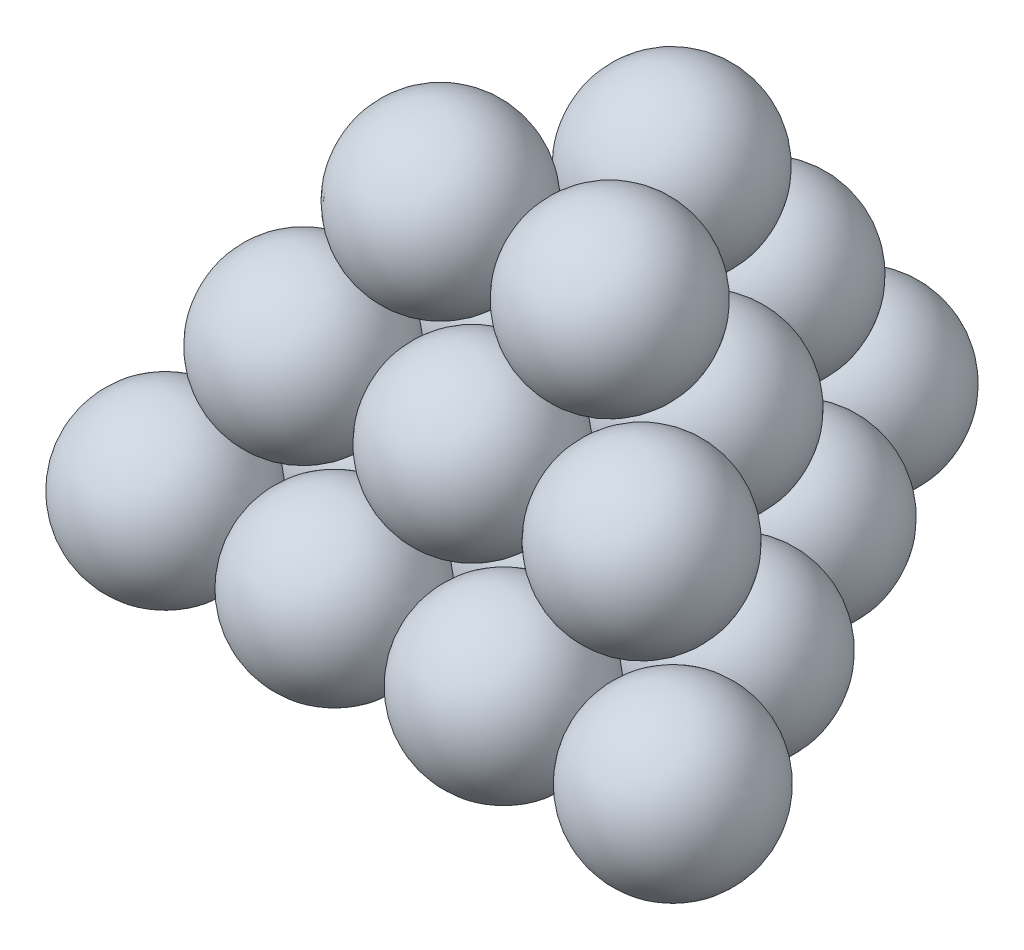
from build123d import *


with BuildPart() as part:
    # 草圖1 → 旋轉1 (revolve)
    with BuildSketch(Plane.XY):
        with BuildLine():
            ThreePointArc((0, -30), (30, 0), (0, 30))
            Line((0, 30), (0, -30))
        make_face()
    revolve(axis=Axis((0, 30, 0), (0, -1, 0)))


with BuildPart() as body_2:
    # 草圖1<8> → 旋轉2 (revolve)
    with BuildSketch(Plane.XY):
        with BuildLine():
            ThreePointArc((60, -30), (90, 0), (60, 30))
            Line((60, 30), (60, -30))
        make_face()
    revolve(axis=Axis((60, 30, 0), (0, -1, 0)))


with BuildPart() as body_3:
    # 草圖1<9> → 旋轉3 (revolve)
    with BuildSketch(Plane.XY):
        with BuildLine():
            ThreePointArc((120.355011354, -29.997899375), (149.999474839, 0.177508784), (120, 30))
            Line((120, 30), (120, -30))
            ThreePointArc((120, -30), (120.177508784, -29.999474839), (120.355011354, -29.997899375))
        make_face()
    revolve(axis=Axis((120, -30, 0), (0, -1, 0)))


with BuildPart() as body_4:
    # 草圖1<10> → 旋轉4 (revolve)
    with BuildSketch(Plane.XY):
        with BuildLine():
            Line((180, 30), (180, -30))
            ThreePointArc((180, -30), (210, 0), (180, 30))
        make_face()
    revolve(axis=Axis((180, 30, 0), (0, -1, 0)))


with BuildPart() as body_5:
    # 草圖2 → 旋轉5 (revolve)
    with BuildSketch(Plane(origin=(0, 0, 0), x_dir=(1, 0, 0), z_dir=(0, 1, 0))):
        with BuildLine():
            ThreePointArc((90, 103.923048454), (60, 133.923048454), (30, 103.923048454))
            Line((30, 103.923048454), (90, 103.923048454))
        make_face()
        with BuildLine():
            ThreePointArc((150, 103.923048454), (120, 133.923048454), (90, 103.923048454))
            Line((90, 103.923048454), (150, 103.923048454))
        make_face()
    revolve(axis=Axis((12.758715889, 0, -103.923048454), (1, 0, 0)))


with BuildPart() as body_6:
    # 草圖2<5> → 旋轉6 (revolve)
    with BuildSketch(Plane(origin=(0, 0, 0), x_dir=(1, 0, 0), z_dir=(0, 1, 0))):
        with BuildLine():
            Line((60, 51.961524227), (0, 51.961524227))
            ThreePointArc((0, 51.961524227), (30, 21.961524227), (60, 51.961524227))
        make_face()
        with BuildLine():
            Line((180, 51.961524227), (120, 51.961524227))
            ThreePointArc((120, 51.961524227), (150, 21.961524227), (180, 51.961524227))
        make_face()
    revolve(axis=Axis((-15.55147478, 0, -51.961524227), (1, 0, 0)))


with BuildPart() as body_7:
    # 草圖2<6> → 旋轉7 (revolve)
    with BuildSketch(Plane(origin=(0, 0, 0), x_dir=(1, 0, 0), z_dir=(0, 1, 0))):
        with BuildLine():
            ThreePointArc((120, 155.884572681), (90, 185.884572681), (60, 155.884572681))
            Line((60, 155.884572681), (120, 155.884572681))
        make_face()
    revolve(axis=Axis((42.056471349, 0, -155.884572681), (1, 0, 0)))


with BuildPart() as body_8:
    # 草圖3 → 旋轉8 (revolve)
    with BuildSketch(Plane(origin=(0, 0, 0), x_dir=(1, 0, 0), z_dir=(0, 1, 0))):
        with BuildLine():
            ThreePointArc((120, 51.961524227), (90, 81.961524227), (60, 51.961524227))
            Line((60, 51.961524227), (120, 51.961524227))
        make_face()
    revolve(axis=Axis((47.949574232, 0, -51.961524227), (1, 0, 0)))


with BuildPart() as body_9:
    # 草圖4 → 旋轉9 (revolve)
    with BuildSketch(Plane(origin=(0, 50, 0), x_dir=(1, 0, 0), z_dir=(0, 1, 0))):
        with BuildLine():
            ThreePointArc((120, 122.861089816), (90, 152.861089816), (60, 122.861089816))
            Line((60, 122.861089816), (120, 122.861089816))
        make_face()
    revolve(axis=Axis((120, 50, -122.861089816), (1, 0, 0)))


with BuildPart() as body_10:
    # 草圖4<6> → 旋轉10 (revolve)
    with BuildSketch(Plane(origin=(0, 50, 0), x_dir=(1, 0, 0), z_dir=(0, 1, 0))):
        with BuildLine():
            ThreePointArc((90, 70.899565588), (120, 40.899565588), (150, 70.899565588))
            Line((150, 70.899565588), (90, 70.899565588))
        make_face()
        with BuildLine():
            ThreePointArc((30, 70.899565588), (60, 40.899565588), (90, 70.899565588))
            Line((90, 70.899565588), (30, 70.899565588))
        make_face()
    revolve(axis=Axis((30, 50, -70.899565588), (-1, 0, 0)))


with BuildPart() as body_11:
    # 草圖4<7> → 旋轉11 (revolve)
    with BuildSketch(Plane(origin=(0, 50, 0), x_dir=(1, 0, 0), z_dir=(0, 1, 0))):
        with BuildLine():
            Line((180, 18.938041361), (120, 18.938041361))
            ThreePointArc((120, 18.938041361), (150, -11.061958639), (180, 18.938041361))
        make_face()
        with BuildLine():
            Line((120, 18.938041361), (60, 18.938041361))
            ThreePointArc((60, 18.938041361), (90, -11.061958639), (120, 18.938041361))
        make_face()
        with BuildLine():
            Line((60, 18.938041361), (0, 18.938041361))
            ThreePointArc((0, 18.938041361), (30, -11.061958639), (60, 18.938041361))
        make_face()
    revolve(axis=Axis((30, 50, -18.938041361), (1, 0, 0)))


with BuildPart() as body_12:
    # 草圖5 → 旋轉12 (revolve)
    with BuildSketch(Plane(origin=(0, 100, 0), x_dir=(1, 0, 0), z_dir=(0, 1, 0))):
        with BuildLine():
            Line((150, 37.629668848), (90, 37.629668848))
            ThreePointArc((90, 37.629668848), (120, 7.629668848), (150, 37.629668848))
        make_face()
        with BuildLine():
            Line((90, 37.629668848), (30, 37.629668848))
            ThreePointArc((30, 37.629668848), (60, 7.629668848), (90, 37.629668848))
        make_face()
    revolve(axis=Axis((150, 100, -37.629668848), (1, 0, 0)))


with BuildPart() as body_13:
    # 草圖5<5> → 旋轉13 (revolve)
    with BuildSketch(Plane(origin=(0, 100, 0), x_dir=(1, 0, 0), z_dir=(0, 1, 0))):
        with BuildLine():
            Line((60, 89.591193075), (120, 89.591193075))
            ThreePointArc((120, 89.591193075), (90, 119.591193075), (60, 89.591193075))
        make_face()
    revolve(axis=Axis((120, 100, -89.591193075), (1, 0, 0)))


solid = Compound([part.part, body_2.part, body_3.part, body_4.part, body_5.part, body_6.part, body_7.part, body_8.part, body_9.part, body_10.part, body_11.part, body_12.part, body_13.part])
